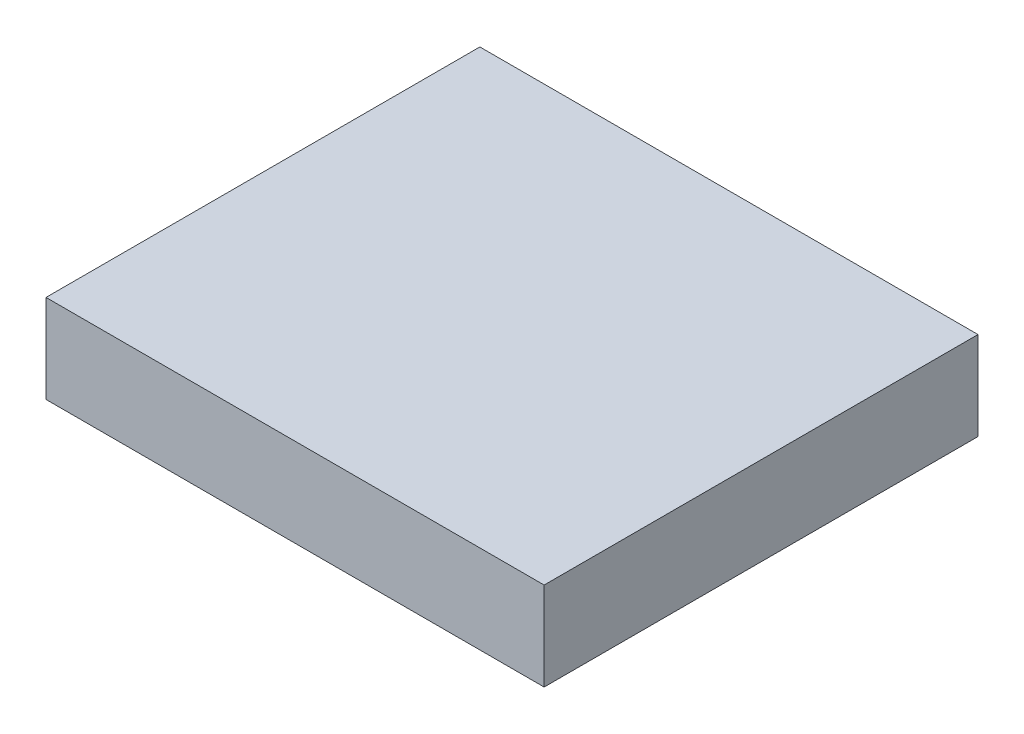
from build123d import *

# Parameters (mm, degrees)
OVEN_PLENUM_KUTUSU_1_START = -40
SKETCH1_W                  = 620
SKETCH1_H                  = 110
OVEN_PLENUM_KUTUSU_1_DEPTH = 540


with BuildPart() as part:
    # Sketch1 → OVEN_plenum_kutusu_1 (new body)
    with BuildSketch(Plane.XY.offset(OVEN_PLENUM_KUTUSU_1_START)):
        with Locations((350, 1745)):
            Rectangle(SKETCH1_W, SKETCH1_H)
    extrude(amount=-OVEN_PLENUM_KUTUSU_1_DEPTH)


solid = part.part
